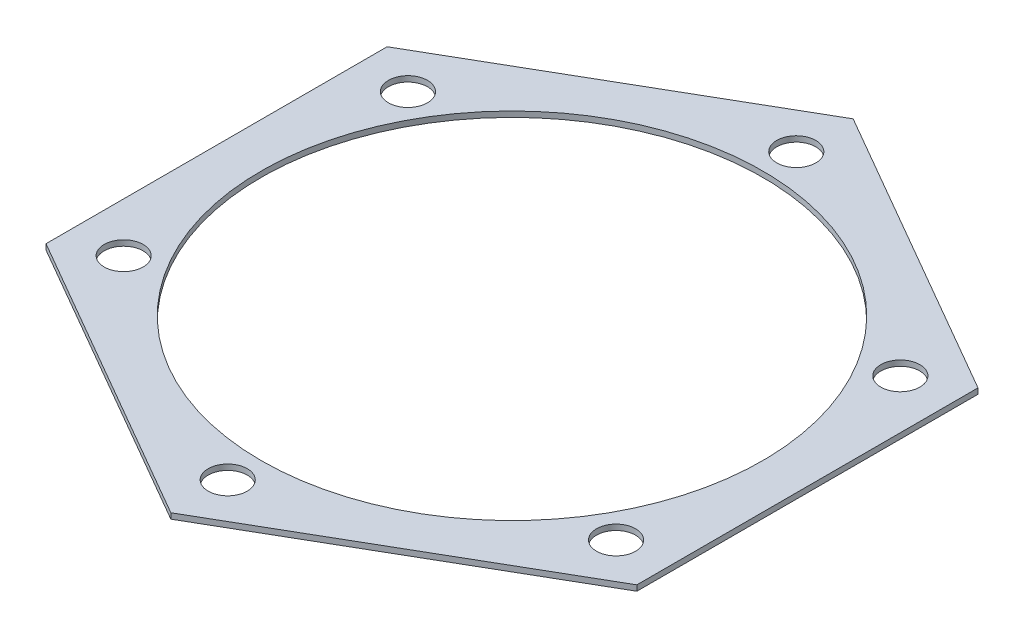
from build123d import *

# Parameters (mm, degrees)
BOSS_EXTRUDE1_DEPTH = 1
SKETCH2_R           = 45
SKETCH2_R_2         = 3.5
CUT_EXTRUDE1_DEPTH  = 81.96501302


with BuildPart() as part:
    # Sketch1 → Boss-Extrude1 (new body)
    with BuildSketch(Plane(origin=(0, 0, 0), x_dir=(1, 0, 0), z_dir=(0, 1, 0))):
        Polygon((0, 61.199128534), (-53, 30.599564267), (-53, -30.599564267), (0, -61.199128534), (53, -30.599564267), (53, 30.599564267), align=None)
    extrude(amount=BOSS_EXTRUDE1_DEPTH)

    # Sketch2 → Cut-Extrude1 (cut, through all)
    with BuildSketch(Plane(origin=(0, 1, 0), x_dir=(1, 0, 0), z_dir=(0, 1, 0))):
        with Locations(Location((0, 0, 0), (0, 0, 270))):
            Circle(SKETCH2_R)
        with Locations(Location((0, 51, 0), (0, 0, 270))):
            Circle(SKETCH2_R_2)
        with Locations(Location((44.167295593, 25.5, 0), (0, 0, 270))):
            Circle(SKETCH2_R_2)
        with Locations(Location((44.167295593, -25.5, 0), (0, 0, 270))):
            Circle(SKETCH2_R_2)
        with Locations(Location((0, -51, 0), (0, 0, 270))):
            Circle(SKETCH2_R_2)
        with Locations(Location((-44.167295593, -25.5, 0), (0, 0, 270))):
            Circle(SKETCH2_R_2)
        with Locations(Location((-44.167295593, 25.5, 0), (0, 0, 270))):
            Circle(SKETCH2_R_2)
    extrude(amount=-CUT_EXTRUDE1_DEPTH, mode=Mode.SUBTRACT)


solid = part.part
